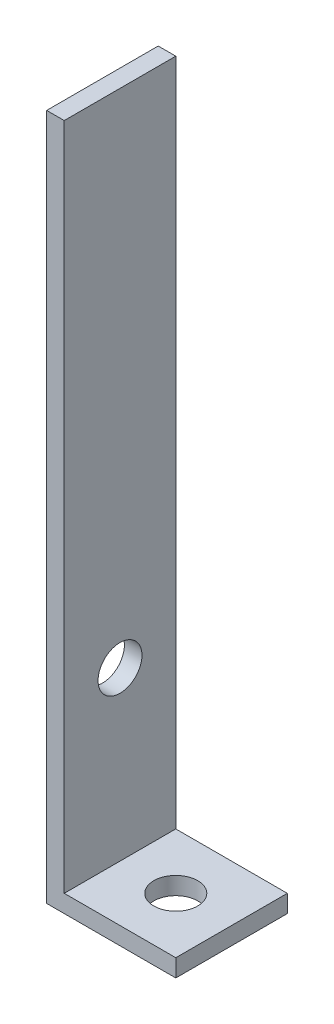
from build123d import *

# Parameters (mm, degrees)
SKETCH1_W             = 14.7
SKETCH1_H             = 2
SKETCH1_W_2           = 2
SKETCH1_H_2           = 76.2
BOSS_EXTRUDE1_DEPTH   = 12.7
F_5_0MM_DOWEL_HOLE1_D = 5
F_5_0MM_DOWEL_HOLE2_D = 5


with BuildPart() as part:
    # Sketch1 → Boss-Extrude1 (new body)
    with BuildSketch(Plane.XY):
        with Locations((7.35, 1)):
            Rectangle(SKETCH1_W, SKETCH1_H)
        with Locations((1, 40.1)):
            Rectangle(SKETCH1_W_2, SKETCH1_H_2)
    extrude(amount=BOSS_EXTRUDE1_DEPTH)

    # Ø5.0mm Dowel Hole1 (through all)
    with Locations(Plane(origin=(2, 0, 0), x_dir=(0, 0, -1), z_dir=(1, 0, 0))):
        with Locations((-6.35, 21.05)):
            Hole(F_5_0MM_DOWEL_HOLE1_D / 2)

    # Ø5.0mm Dowel Hole2 (through all)
    with Locations(Plane(origin=(0, 2, 0), x_dir=(1, 0, 0), z_dir=(0, 1, 0))):
        with Locations((8.35, -6.35)):
            Hole(F_5_0MM_DOWEL_HOLE2_D / 2)


solid = part.part
